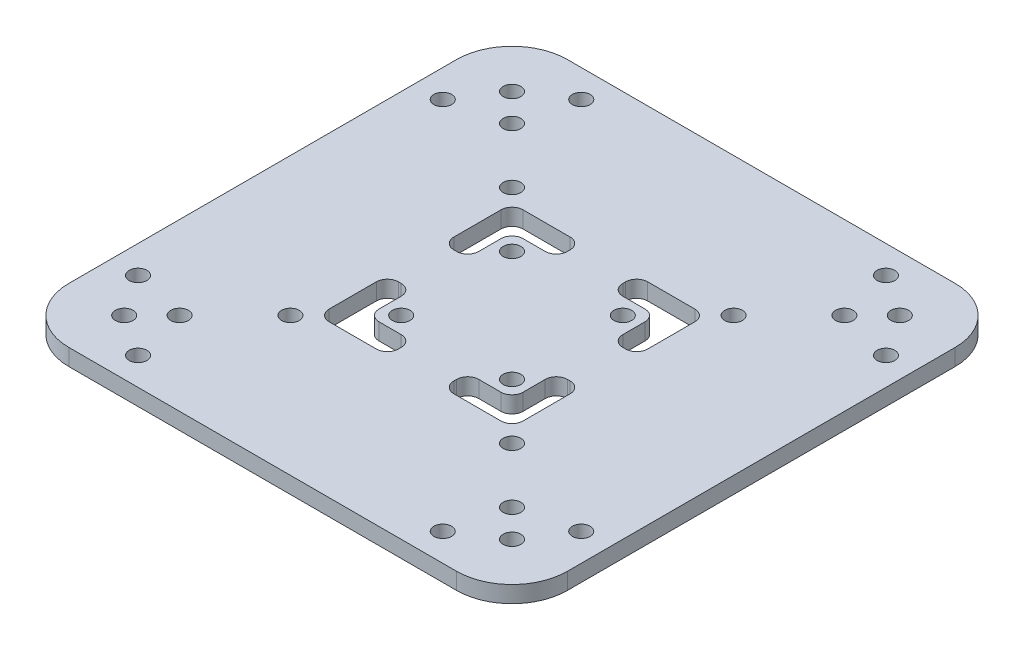
from build123d import *

# Parameters (mm, degrees)
SKETCH_1_W          = 90
SKETCH_1_H          = 90
SKETCH_1_R          = 1.6
EXTRUDE_1_DEPTH     = 3
SKETCH_3_R          = 1.6
CUT_EXTRUDE_2_DEPTH = 64.710281745
FILLET_1_R          = 2
FILLET_3_R          = 10
SKETCH_6_R          = 1.6
CUT_EXTRUDE_4_DEPTH = 64.710281745
SKETCH_12_R         = 1.6
CUT_EXTRUDE_5_DEPTH = 64.710281745


with BuildPart() as part:
    # 草图1 → 凸台-拉伸1 (new body)
    with BuildSketch(Plane(origin=(0, 0, 0), x_dir=(1, 0, 0), z_dir=(0, 1, 0))):
        Rectangle(SKETCH_1_W, SKETCH_1_H)
        with Locations(Location((-35, -35, 0), (0, 0, 270))):
            Circle(SKETCH_1_R, mode=Mode.SUBTRACT)
        with Locations(Location((35, -35, 0), (0, 0, 270))):
            Circle(SKETCH_1_R, mode=Mode.SUBTRACT)
        Polygon((17.5, -17.5), (5, -17.5), (5, -13), (13, -13), (13, -5), (17.5, -5), align=None, mode=Mode.SUBTRACT)
        Polygon((-13, -13), (-5, -13), (-5, -17.5), (-17.5, -17.5), (-17.5, -5), (-13, -5), align=None, mode=Mode.SUBTRACT)
        Polygon((-17.5, 5), (-17.5, 17.5), (-5, 17.5), (-5, 13), (-13, 13), (-13, 5), align=None, mode=Mode.SUBTRACT)
        Polygon((5, 17.5), (17.5, 17.5), (17.5, 5), (13, 5), (13, 13), (5, 13), align=None, mode=Mode.SUBTRACT)
        with Locations(Location((-35, 35, 0), (0, 0, 270))):
            Circle(SKETCH_1_R, mode=Mode.SUBTRACT)
        with Locations(Location((35, 35, 0), (0, 0, 270))):
            Circle(SKETCH_1_R, mode=Mode.SUBTRACT)
        with Locations(Location((10, -10, 0), (0, 0, 270))):
            Circle(SKETCH_1_R, mode=Mode.SUBTRACT)
        with Locations(Location((-10, -10, 0), (0, 0, 270))):
            Circle(SKETCH_1_R, mode=Mode.SUBTRACT)
        with Locations(Location((10, 10, 0), (0, 0, 270))):
            Circle(SKETCH_1_R, mode=Mode.SUBTRACT)
        with Locations(Location((-10, 10, 0), (0, 0, 270))):
            Circle(SKETCH_1_R, mode=Mode.SUBTRACT)
    extrude(amount=EXTRUDE_1_DEPTH)

    # 草图3 → 切除-拉伸2 (cut, through all)
    with BuildSketch(Plane(origin=(0, 3, 0), x_dir=(1, 0, 0), z_dir=(0, 1, 0))):
        with Locations(Location((-20, 20, 0), (0, 0, 270))):
            Circle(SKETCH_3_R)
        with Locations(Location((20, 20, 0), (0, 0, 270))):
            Circle(SKETCH_3_R)
        with Locations(Location((20, -20, 0), (0, 0, 270))):
            Circle(SKETCH_3_R)
        with Locations(Location((-20, -20, 0), (0, 0, 270))):
            Circle(SKETCH_3_R)
    extrude(amount=-CUT_EXTRUDE_2_DEPTH, mode=Mode.SUBTRACT)

    # 圆角1
    fillet_1_edges = [part.edges().sort_by_distance(p)[0] for p in [
        (17.5, 1.5, 17.5),
        (17.5, 1.5, 5),
        (13, 1.5, 5),
        (13, 1.5, 13),
        (5, 1.5, 13),
        (5, 1.5, 17.5),
        (-5, 1.5, 13),
        (-13, 1.5, 13),
        (-13, 1.5, 5),
        (-17.5, 1.5, 5),
        (-17.5, 1.5, 17.5),
        (-5, 1.5, 17.5),
        (-5, 1.5, -17.5),
        (-17.5, 1.5, -17.5),
        (-17.5, 1.5, -5),
        (-13, 1.5, -5),
        (-13, 1.5, -13),
        (-5, 1.5, -13),
        (17.5, 1.5, -5),
        (17.5, 1.5, -17.5),
        (5, 1.5, -17.5),
        (5, 1.5, -13),
        (13, 1.5, -13),
        (13, 1.5, -5),
    ]]
    fillet(fillet_1_edges, radius=FILLET_1_R)

    # 圆角3
    fillet_3_edges = [part.edges().sort_by_distance(p)[0] for p in [
        (-45, 1.5, -45),
        (45, 1.5, -45),
        (45, 1.5, 45),
        (-45, 1.5, 45),
    ]]
    fillet(fillet_3_edges, radius=FILLET_3_R)

    # 草图6 → 切除-拉伸4 (cut, through all)
    with BuildSketch(Plane(origin=(0, 3, 0), x_dir=(1, 0, 0), z_dir=(0, 1, 0))):
        with Locations(Location((-27.5, 40, 0), (0, 0, 270))):
            Circle(SKETCH_6_R)
        with Locations(Location((27.5, 40, 0), (0, 0, 270))):
            Circle(SKETCH_6_R)
        with Locations(Location((40, 27.5, 0), (0, 0, 270))):
            Circle(SKETCH_6_R)
        with Locations(Location((27.5, -40, 0), (0, 0, 270))):
            Circle(SKETCH_6_R)
        with Locations(Location((-40, -27.5, 0), (0, 0, 270))):
            Circle(SKETCH_6_R)
        with Locations(Location((40, -27.5, 0), (0, 0, 270))):
            Circle(SKETCH_6_R)
        with Locations(Location((-27.5, -40, 0), (0, 0, 270))):
            Circle(SKETCH_6_R)
        with Locations(Location((-40, 27.5, 0), (0, 0, 270))):
            Circle(SKETCH_6_R)
    extrude(amount=-CUT_EXTRUDE_4_DEPTH, mode=Mode.SUBTRACT)

    # 草图12 → 切除-拉伸5 (cut, through all)
    with BuildSketch(Plane(origin=(0, 3, 0), x_dir=(1, 0, 0), z_dir=(0, 1, 0))):
        with Locations(Location((-30, 30, 0), (0, 0, 270))):
            Circle(SKETCH_12_R)
        with Locations(Location((30, 30, 0), (0, 0, 270))):
            Circle(SKETCH_12_R)
        with Locations(Location((30, -30, 0), (0, 0, 270))):
            Circle(SKETCH_12_R)
        with Locations(Location((-30, -30, 0), (0, 0, 270))):
            Circle(SKETCH_12_R)
    extrude(amount=-CUT_EXTRUDE_5_DEPTH, mode=Mode.SUBTRACT)


solid = part.part
